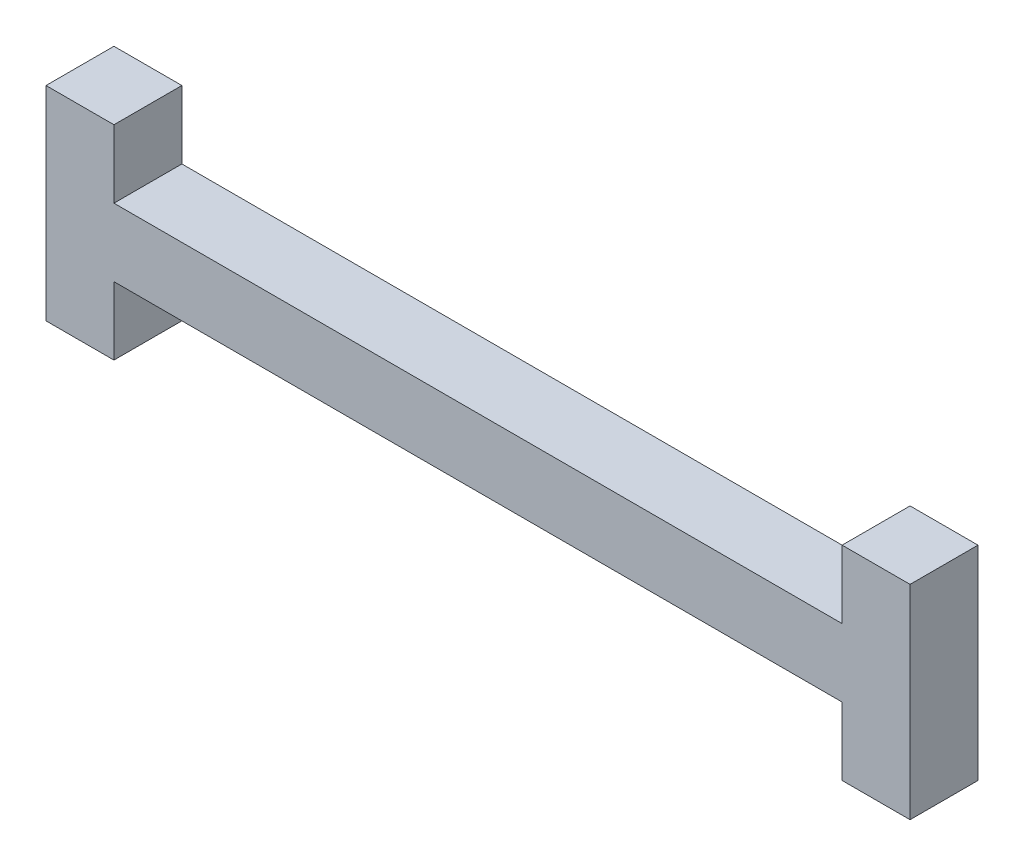
from build123d import *

# Parameters (mm, degrees)
BOSS_EXTRUDE1_DEPTH = 5


with BuildPart() as part:
    # Sketch1 → Boss-Extrude1 (new body)
    with BuildSketch(Plane.XY):
        Polygon((0, 0), (0, -15), (5, -15), (5, -10), (58.585, -10), (58.585, -15), (63.585, -15), (63.585, 0), (58.585, 0), (58.585, -5), (5, -5), (5, 0), align=None)
    extrude(amount=BOSS_EXTRUDE1_DEPTH)


solid = part.part
